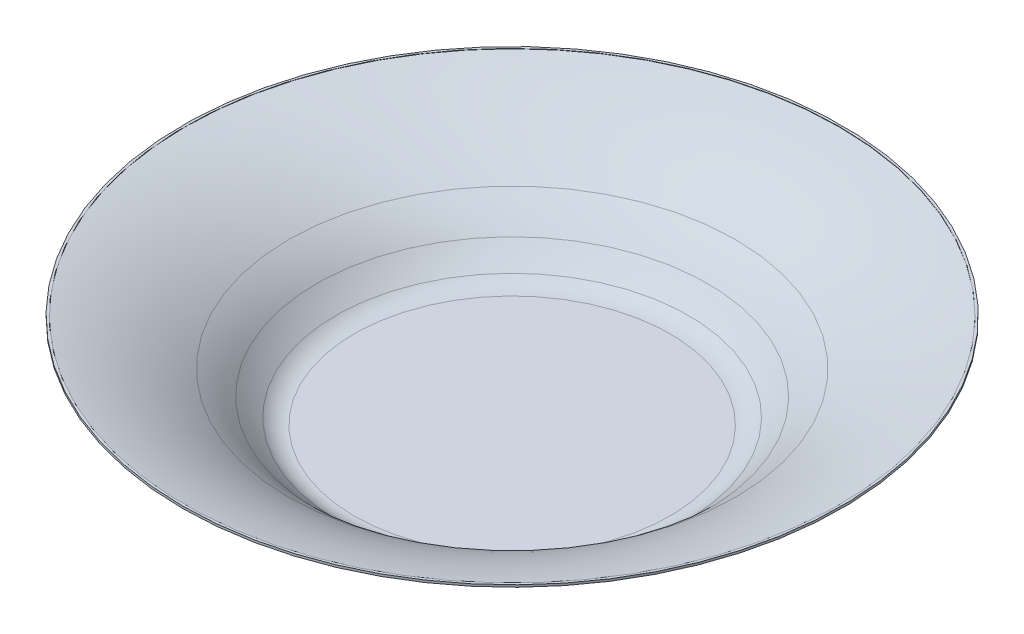
from build123d import *

# Parameters (mm, degrees)
SHELL2_T = -1


with BuildPart() as part:
    # Sketch1 → Revolve3 (revolve)
    with BuildSketch(Plane.XY, mode=Mode.PRIVATE) as revolve3_sk:
        with BuildLine():
            Line((0, 0), (70.170274015, 0))
            ThreePointArc((70.170274015, 0), (74.867019818, 0.813696051), (79.016316154, 3.159940352))
            ThreePointArc((79.016316154, 3.159940352), (83.467476244, 7.068955028), (87.638838201, 11.275255219))
            ThreePointArc((87.638838201, 11.275255219), (93.444928024, 16.921383546), (99.811810502, 21.926605983))
            ThreePointArc((99.811810502, 21.926605983), (122.101594507, 34.410654829), (146.474870989, 42.06763466))
            Line((146.474870989, 42.06763466), (146.474870989, 43.043574036))
            Line((146.474870989, 43.043574036), (0, 43.043574036))
            Line((0, 43.043574036), (0, 0))
        make_face()
    revolve(revolve3_sk.sketch.rotate(Axis((0, 43.043574036, 0), (0, -1, 0)), 90), axis=Axis((0, 43.043574036, 0), (0, -1, 0)))

    # Shell2
    shell2_openings = [part.faces().sort_by_distance(p)[0] for p in [
        (0, 43.043574036, 0),
    ]]
    offset(amount=SHELL2_T, openings=shell2_openings, kind=Kind.INTERSECTION)


solid = part.part
